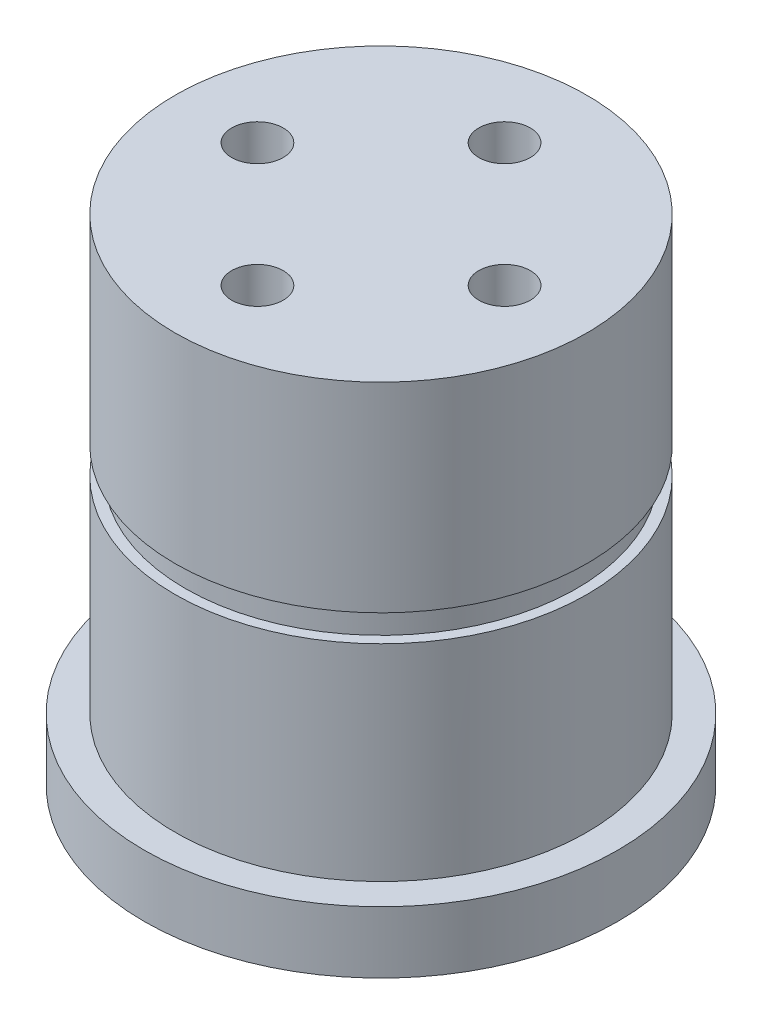
from build123d import *

# Parameters (mm, degrees)
SKETCH_1_R          = 10
EXTRUDE_1_DEPTH     = 24
M3X0_52_D           = 2.5
M3X0_52_DEPTH       = 8.5
M3X0_52_TIP         = 0.751075774
EXTRUDE_START       = 3
SKETCH_10_R         = 11.5
SKETCH_10_R_2       = 10
EXTRUDE_2_DEPTH     = 3
SKETCH_8_R          = 10
SKETCH_8_R_2        = 9.5
CUT_EXTRUDE_1_DEPTH = 1.3


with BuildPart() as part:
    # Эскиз1 → Бобышка-Вытянуть1 (new body)
    with BuildSketch(Plane(origin=(0, 0, 0), x_dir=(1, 0, 0), z_dir=(0, 1, 0))):
        with Locations(Location((0, 0, 0), (0, 0, 270))):
            Circle(SKETCH_1_R)
    extrude(amount=EXTRUDE_1_DEPTH)

    # Отверстие обработанное метчиком M3x0.52
    with Locations(Plane(origin=(-4.838819278, 24, -4.760025704), x_dir=(-1, 0, 0), z_dir=(0, 1, 0))):
        with Locations((-4.838819278, -1.239974296), (-10.838819278, 4.760025704), (-4.838819278, 10.760025704), (1.161180722, 4.760025704)):
            Hole(M3X0_52_D / 2, depth=M3X0_52_DEPTH)
            with Locations((0, 0, -(M3X0_52_DEPTH + M3X0_52_TIP / 2))):  # 118° drill point
                Cone(0, M3X0_52_D / 2, M3X0_52_TIP, mode=Mode.SUBTRACT)

    # Эскиз10 → Бобышка-Вытянуть2 (add)
    with BuildSketch(Plane(origin=(0, 3, 0), x_dir=(-1, 0, 0), z_dir=(0, -1, 0)).offset(EXTRUDE_START)):
        with Locations(Location((0, 0, 0), (0, 0, 270))):
            Circle(SKETCH_10_R)
        with Locations(Location((0, 0, 0), (0, 0, 90))):
            Circle(SKETCH_10_R_2, mode=Mode.SUBTRACT)
    extrude(amount=-EXTRUDE_2_DEPTH)

    # Эскиз8 → Вырез-Вытянуть1 (cut)
    with BuildSketch(Plane(origin=(0, 13, 0), x_dir=(1, 0, 0), z_dir=(0, 1, 0))):
        with Locations(Location((0, 0, 0), (0, 0, 270))):
            Circle(SKETCH_8_R)
        with Locations(Location((0, 0, 0), (0, 0, 270))):
            Circle(SKETCH_8_R_2, mode=Mode.SUBTRACT)
    extrude(amount=CUT_EXTRUDE_1_DEPTH, mode=Mode.SUBTRACT)


solid = part.part
